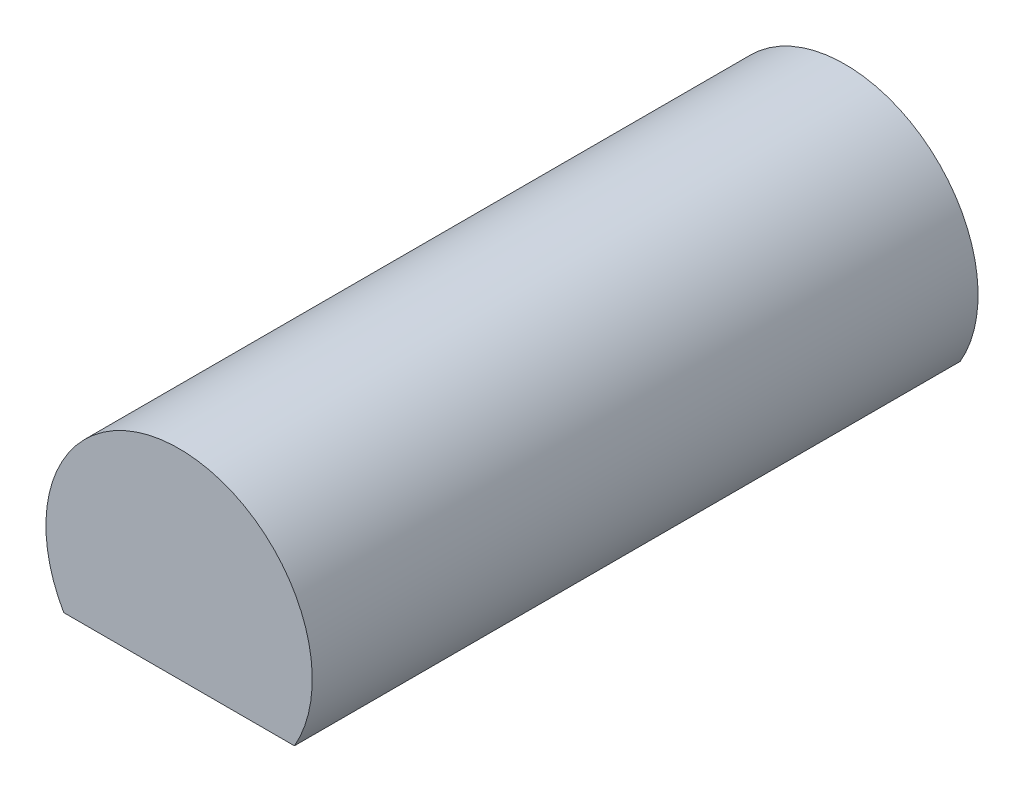
from build123d import *

# Parameters (mm, degrees)
BOSS_EXTRUDE1_DEPTH = 10


with BuildPart() as part:
    # Sketch2 → Boss-Extrude1 (new body)
    with BuildSketch(Plane.XY):
        with BuildLine():
            Line((-1.732050808, -1), (0, -1))
            Line((0, -1), (1.732050808, -1))
            ThreePointArc((1.732050808, -1), (0, 2), (-1.732050808, -1))
        make_face()
    extrude(amount=BOSS_EXTRUDE1_DEPTH)


solid = part.part
